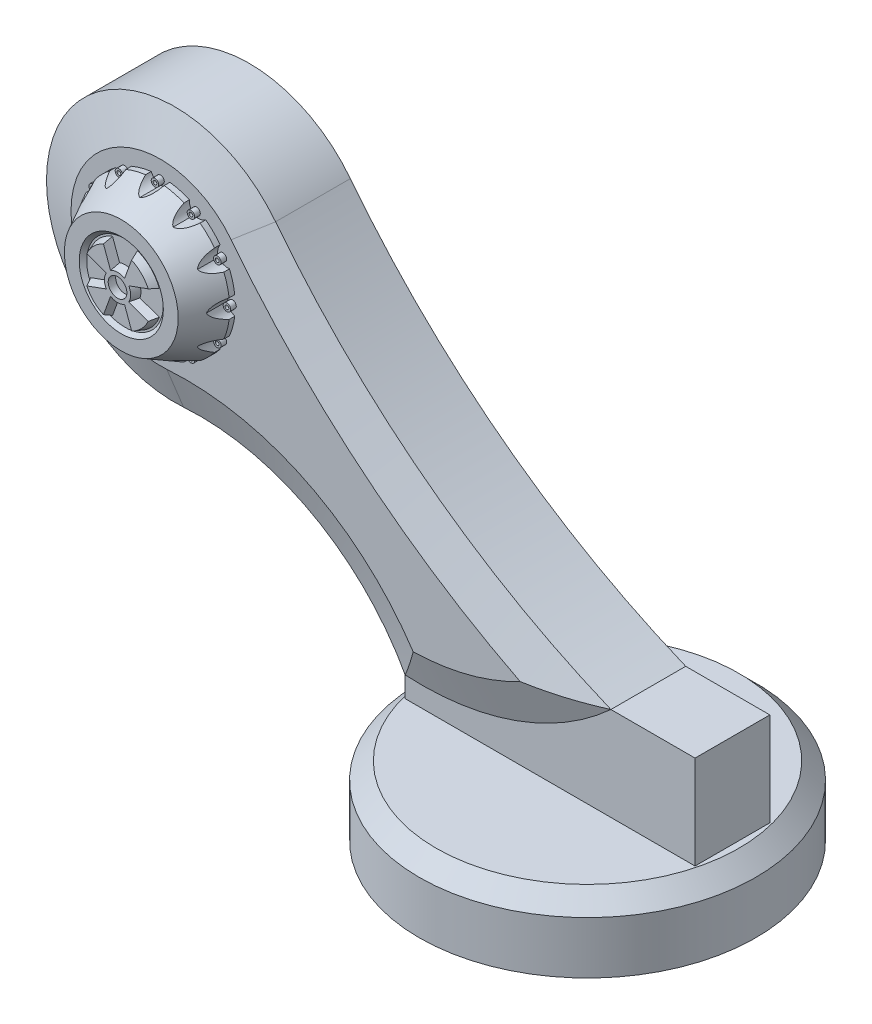
from build123d import *

# Parameters (mm, degrees)
SKETCH1_R            = 90
BOSS_EXTRUDE1_DEPTH  = 37
CHAMFER1_SIZE        = 9
SKETCH2_W            = 155
SKETCH2_H            = 40
BOSS_EXTRUDE2_DEPTH  = 50
CUT_EXTRUDE1_DEPTH   = 50
SKETCH5_R            = 68.5
BOSS_EXTRUDE3_DEPTH  = 20
BOSS_EXTRUDE4_DEPTH  = 7.5
BOSS_EXTRUDE4_TAPER  = 70
SKETCH7_R            = 40
BOSS_EXTRUDE7_DEPTH  = 3
SKETCH13_R           = 40
BOSS_EXTRUDE8_DEPTH  = 18
BOSS_EXTRUDE8_TAPER  = 28
CUT_EXTRUDE2_REACH   = 394.445
SKETCH16_R           = 2
SKETCH16_R_2         = 1
BOSS_EXTRUDE10_DEPTH = 3
CIRPATTERN2_COUNT    = 12
SKETCH18_R           = 22.5
CUT_EXTRUDE3_DEPTH   = 2
CUT_EXTRUDE3_DRAFT   = -45
BOSS_EXTRUDE11_DEPTH = 4
BOSS_EXTRUDE11_DRAFT = 20
SKETCH21_R           = 5
CUT_EXTRUDE4_DEPTH   = 4
SKETCH22_R           = 15
CUT_EXTRUDE5_DEPTH   = 20
SKETCH23_R           = 15
CUT_EXTRUDE6_DEPTH   = 20


with BuildPart() as part:
    # Sketch1 → Boss-Extrude1 (new body)
    with BuildSketch(Plane(origin=(0, 0, 0), x_dir=(1, 0, 0), z_dir=(0, 1, 0))):
        with Locations(Location((0, 0, 0), (0, 0, 270))):
            Circle(SKETCH1_R)
    extrude(amount=BOSS_EXTRUDE1_DEPTH)

    # Chamfer1
    chamfer1_edges = [part.edges().sort_by_distance(p)[0] for p in [
        (0, 37, -90),
    ]]
    chamfer(chamfer1_edges, length=CHAMFER1_SIZE)

    # Sketch2 → Boss-Extrude2 (add)
    with BuildSketch(Plane(origin=(0, 37, 0), x_dir=(1, 0, 0), z_dir=(0, 1, 0))):
        Rectangle(SKETCH2_W, SKETCH2_H)
    extrude(amount=BOSS_EXTRUDE2_DEPTH)

    # Sketch3 → Cut-Extrude1 (cut)
    with BuildSketch(Plane.XY.offset(20)):
        with BuildLine():
            Line((-77.5, 87), (32.5, 87))
            ThreePointArc((32.5, 87), (-18.551432041, 56.363013449), (-77.5, 48))
            Line((-77.5, 48), (-77.5, 87))
        make_face()
    extrude(amount=-CUT_EXTRUDE1_DEPTH, mode=Mode.SUBTRACT)

    # Sketch5 → Boss-Extrude3 (add, symmetric)
    with BuildSketch(Plane.XY):
        with BuildLine():
            ThreePointArc((-146.831004201, 223.203053422), (-136.06539116, 203.348158068), (-132.341921863, 181.07146464))
            ThreePointArc((-132.341921863, 181.07146464), (-150.725311407, 134.374833537), (-196.008355626, 112.742212943))
            ThreePointArc((-196.008355626, 112.742212943), (-127.259214362, 97.751304864), (-77.5, 48))
            ThreePointArc((-77.5, 48), (-18.551432041, 56.363013449), (32.5, 87))
            ThreePointArc((32.5, 87), (-66.026565292, 143.434656399), (-146.831004201, 223.203053422))
        make_face()
        with Locations((-200.841921863, 181.07146464)):
            Circle(SKETCH5_R)
    extrude(amount=BOSS_EXTRUDE3_DEPTH, both=True)

    # Sketch6 → Boss-Extrude4 (add)
    with BuildSketch(Plane.XY.offset(20)):
        with BuildLine():
            ThreePointArc((-77.5, 48), (-18.551432041, 56.363013449), (32.5, 87))
            ThreePointArc((32.5, 87), (-66.026565292, 143.434656399), (-146.831004201, 223.203053422))
            ThreePointArc((-146.831004201, 223.203053422), (-263.420413705, 208.931514152), (-196.008355626, 112.742212943))
            ThreePointArc((-196.008355626, 112.742212943), (-127.259214362, 97.751304864), (-77.5, 48))
        make_face()
    extrude(amount=BOSS_EXTRUDE4_DEPTH, taper=BOSS_EXTRUDE4_TAPER)

    # Sketch7 → Boss-Extrude7 (add)
    with BuildSketch(Plane.XY.offset(27.5)):
        with Locations((-200.841921863, 181.07146464)):
            Circle(SKETCH7_R)
    extrude(amount=BOSS_EXTRUDE7_DEPTH)

    # Sketch13 → Boss-Extrude8 (add)
    with BuildSketch(Plane.XY.offset(30.5)):
        with Locations((-200.841921863, 181.07146464)):
            Circle(SKETCH13_R)
    extrude(amount=BOSS_EXTRUDE8_DEPTH, taper=BOSS_EXTRUDE8_TAPER)

    # Cut-Extrude2: up to this face of the body (flat: up to its plane)
    cut_extrude2_end = Plane(part.part.faces().sort_by_distance((-127.094373399, 138.544802959, 27.5))[0])
    # Sketch14 → Cut-Extrude2 (cut, up to the picked face)
    with BuildSketch(Plane.XY.offset(48.5), mode=Mode.PRIVATE) as cut_extrude2_sk1:
        with BuildLine():
            ThreePointArc((-205.841921863, 220.757734306), (-203.829324562, 218.142026898), (-200.841921863, 216.739208928))
            ThreePointArc((-200.841921863, 216.739208928), (-197.854519165, 218.142026898), (-195.841921863, 220.757734306))
            ThreePointArc((-195.841921863, 220.757734306), (-200.841921863, 221.07146464), (-205.841921863, 220.757734306))
        make_face()
    cut_extrude2_tool1 = split(extrude(cut_extrude2_sk1.sketch, amount=-CUT_EXTRUDE2_REACH, mode=Mode.PRIVATE), bisect_by=cut_extrude2_end, keep=Keep.BOTH, mode=Mode.PRIVATE)
    cut_extrude2 = cut_extrude2_tool1.solids().sort_by(Axis((-200.841922, 219.3116, 48.5), (0, 0, -1)))[0]
    add(cut_extrude2, mode=Mode.SUBTRACT)

    # Sketch16 → Boss-Extrude10 (add)
    with BuildSketch(Plane.XY.offset(27.5)):
        with Locations((-200.841921863, 219.57146464)):
            Circle(SKETCH16_R)
        with Locations((-200.841921863, 219.57146464)):
            Circle(SKETCH16_R_2, mode=Mode.SUBTRACT)
    boss_extrude10 = extrude(amount=BOSS_EXTRUDE10_DEPTH)

    # CirPattern2: Cut-Extrude2, Boss-Extrude10 ×12 about axis
    cirpattern2_axis = Axis((-200.841921863, 181.07146464, 0), (0, 0, 1))
    add([cut_extrude2.rotate(cirpattern2_axis, i * 360 / CIRPATTERN2_COUNT) for i in range(1, CIRPATTERN2_COUNT)], mode=Mode.SUBTRACT)
    add([boss_extrude10.rotate(cirpattern2_axis, i * 360 / CIRPATTERN2_COUNT) for i in range(1, CIRPATTERN2_COUNT)])


with BuildPart() as cut_extrude3_tool:
    # Sketch18 → Cut-Extrude3 (with draft: the straight prism first)
    with BuildSketch(Plane.XY.offset(48.5)):
        with Locations((-200.841921863, 181.07146464)):
            Circle(SKETCH18_R)
    extrude(amount=-CUT_EXTRUDE3_DEPTH)
    # Cut-Extrude3: the draft: its side faces are tilted about the plane it starts from
    cut_extrude3_sides = [cut_extrude3_tool.faces().sort_by_distance(p)[0] for p in [
        (-223.341921863, 181.07146464, 47.5),
    ]]
    draft(cut_extrude3_sides, Plane.XY.offset(48.5), CUT_EXTRUDE3_DRAFT)


with BuildPart() as part_1:
    add(part.part)

    # Cut-Extrude3: cut by cut_extrude3_tool
    add(cut_extrude3_tool.part, mode=Mode.SUBTRACT)


with BuildPart() as boss_extrude11_tool:
    # Sketch20 → Boss-Extrude11 (with draft: the straight prism first)
    with BuildSketch(Plane.XY.offset(46.5)):
        with BuildLine():
            ThreePointArc((-197.934750645, 189.058851917), (-200.841921863, 189.57146464), (-203.749093082, 189.058851917))
            Line((-203.749093082, 189.058851917), (-207.511314658, 199.395470745))
            ThreePointArc((-207.511314658, 199.395470745), (-214.630504096, 194.860046873), (-219.165927969, 187.740857435))
            Line((-219.165927969, 187.740857435), (-208.82930914, 183.978635858))
            ThreePointArc((-208.82930914, 183.978635858), (-209.341921863, 181.07146464), (-208.82930914, 178.164293422))
            Line((-208.82930914, 178.164293422), (-219.165927969, 174.402071845))
            ThreePointArc((-219.165927969, 174.402071845), (-214.630504096, 167.282882407), (-207.511314658, 162.747458535))
            Line((-207.511314658, 162.747458535), (-203.749093082, 173.084077363))
            ThreePointArc((-203.749093082, 173.084077363), (-200.841921863, 172.57146464), (-197.934750645, 173.084077363))
            Line((-197.934750645, 173.084077363), (-194.172529068, 162.747458535))
            ThreePointArc((-194.172529068, 162.747458535), (-187.05333963, 167.282882407), (-182.517915758, 174.402071845))
            Line((-182.517915758, 174.402071845), (-192.854534587, 178.164293422))
            ThreePointArc((-192.854534587, 178.164293422), (-192.341921863, 181.07146464), (-192.854534587, 183.978635858))
            Line((-192.854534587, 183.978635858), (-182.517915758, 187.740857435))
            ThreePointArc((-182.517915758, 187.740857435), (-187.05333963, 194.860046873), (-194.172529068, 199.395470745))
            Line((-194.172529068, 199.395470745), (-197.934750645, 189.058851917))
        make_face()
    extrude(amount=BOSS_EXTRUDE11_DEPTH)
    # Boss-Extrude11: the draft: its side faces are tilted about the plane it starts from
    boss_extrude11_sides = [boss_extrude11_tool.faces().sort_by_distance(p)[0] for p in [
        (-187.686225172, 176.283182633, 48.5),
        (-192.341921863, 181.07146464, 48.5),
        (-187.686225172, 185.859746646, 48.5),
        (-187.05333963, 194.860046873, 48.5),
        (-196.053639857, 194.227161331, 48.5),
        (-200.841921863, 189.57146464, 48.5),
        (-205.63020387, 194.227161331, 48.5),
        (-214.630504096, 194.860046873, 48.5),
        (-213.997618554, 185.859746646, 48.5),
        (-209.341921863, 181.07146464, 48.5),
        (-213.997618554, 176.283182633, 48.5),
        (-214.630504096, 167.282882407, 48.5),
        (-205.63020387, 167.915767949, 48.5),
        (-200.841921863, 172.57146464, 48.5),
        (-196.053639857, 167.915767949, 48.5),
        (-187.05333963, 167.282882407, 48.5),
    ]]
    draft(boss_extrude11_sides, Plane.XY.offset(46.5), BOSS_EXTRUDE11_DRAFT)


with BuildPart() as part_2:
    add(part_1.part)

    # Boss-Extrude11: add boss_extrude11_tool
    add(boss_extrude11_tool.part)

    # Sketch21 → Cut-Extrude4 (cut)
    with BuildSketch(Plane.XY.offset(50.5)):
        with Locations((-200.841921863, 181.07146464)):
            Circle(SKETCH21_R)
    extrude(amount=-CUT_EXTRUDE4_DEPTH, mode=Mode.SUBTRACT)

    # Sketch22 → Cut-Extrude5 (cut)
    with BuildSketch(Plane(origin=(0, 0, -20), x_dir=(-1, 0, 0), z_dir=(0, 0, -1))):
        with Locations((200.841921863, 181.07146464)):
            Circle(SKETCH22_R)
    extrude(amount=-CUT_EXTRUDE5_DEPTH, mode=Mode.SUBTRACT)

    # Sketch23 → Cut-Extrude6 (cut)
    with BuildSketch(Plane.XZ):
        with Locations(Location((0, 0, 0), (0, 0, 270))):
            Circle(SKETCH23_R)
    extrude(amount=-CUT_EXTRUDE6_DEPTH, mode=Mode.SUBTRACT)


solid = part_2.part
